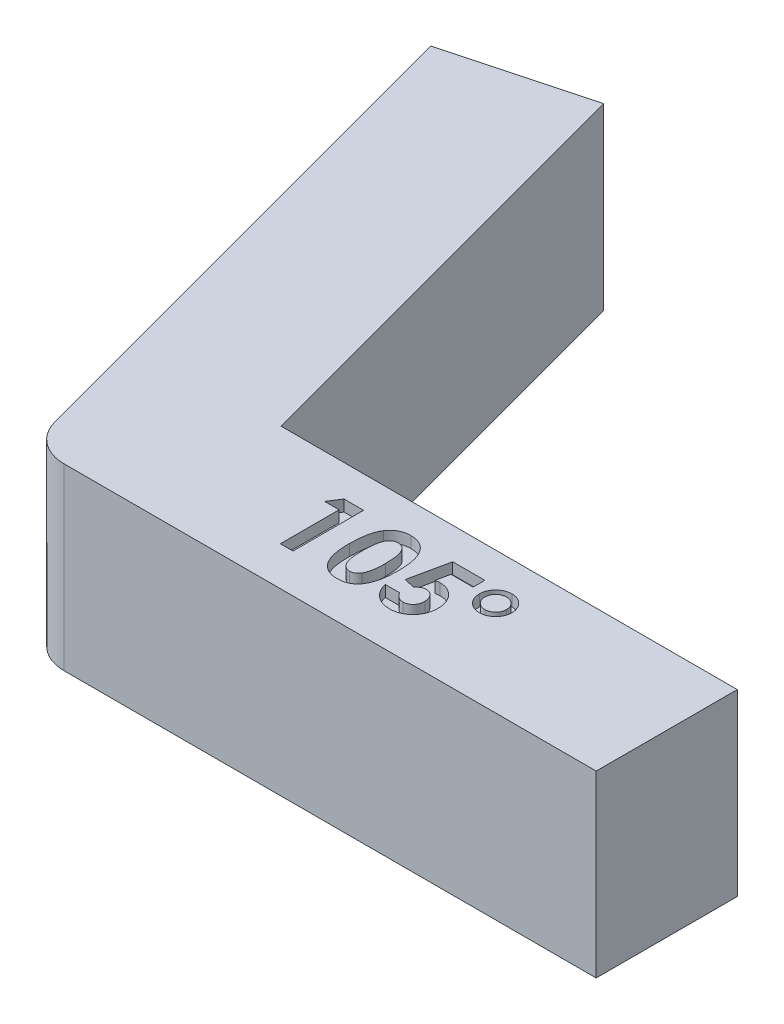
from build123d import *

# Parameters (mm, degrees)
BOSS_EXTRUDE1_DEPTH = 12.7
CUT_EXTRUDE1_DEPTH  = 0.8
FILLET1_R           = 3


with BuildPart() as part:
    # Sketch1 → Boss-Extrude1 (new body)
    with BuildSketch(Plane(origin=(0, 0, 0), x_dir=(1, 0, 0), z_dir=(0, 1, 0))):
        Polygon((0, 0), (-10.352761804, 38.637033052), (-0.693503541, 41.225223503), (7.67326988, 10), (40, 10), (40, 0), align=None)
    extrude(amount=BOSS_EXTRUDE1_DEPTH)

    # Sketch2 → Cut-Extrude1 (cut)
    # profile 1 of 4: a face of its own
    with BuildSketch(Plane(origin=(0, 12.7, 0), x_dir=(1, 0, 0), z_dir=(0, 1, 0))):
        Polygon((14.370390329, 7.760106671), (15.75760988, 7.760106671), (15.75760988, 2.760106671), (14.860173983, 2.760106671), (14.860173983, 6.926773337), (13.834532957, 6.926773337), align=None)
    # profile 2 of 4: a face of its own
    with BuildSketch(Plane(origin=(0, 12.7, 0), x_dir=(1, 0, 0), z_dir=(0, 1, 0))):
        with BuildLine():
            add(Edge.make_bspline(
                [(18.979765329, 7.888311799), (19.023204951, 7.887666925), (19.108618855, 7.886398932), (19.234417457, 7.87266553), (19.355596292, 7.851918189), (19.472629426, 7.822982884), (19.584674444, 7.784688038), (19.692546831, 7.738849764), (19.794962595, 7.68306375), (19.893227863, 7.620050582), (19.987304784, 7.548710743), (20.074932285, 7.467379643), (20.15771063, 7.377928714), (20.233847973, 7.279005618), (20.305030397, 7.171510166), (20.371024011, 7.055425313), (20.431323617, 6.930182901), (20.486605028, 6.795556919), (20.536037841, 6.649529384), (20.577675037, 6.490425295), (20.613385901, 6.318208318), (20.643528389, 6.132449779), (20.666311239, 5.932902762), (20.681667338, 5.719699834), (20.69220542, 5.49325202), (20.693065465, 5.33791068), (20.693507316, 5.258103466)],
                knots=[0, 0, 0, 0, 0.879237366, 1.728815576, 2.559023295, 3.367336655, 4.166867292, 4.954216142, 5.737608147, 6.525189134, 7.316157332, 8.124696809, 8.942788509, 9.781158001, 10.649253743, 11.551476218, 12.482711956, 13.461909668, 14.496590415, 15.601789533, 16.789733467, 18.056700938, 19.410929216, 20.8549011, 22.384193279, 24, 24, 24, 24], degree=3))
            add(Edge.make_bspline(
                [(20.693507316, 5.258103466), (20.693029794, 5.177297774), (20.692101978, 5.020293763), (20.682105409, 4.791774742), (20.664890846, 4.577023833), (20.642703474, 4.376063253), (20.612312843, 4.188999127), (20.57672119, 4.015347083), (20.534426763, 3.855170067), (20.483365649, 3.708828992), (20.428418857, 3.573966578), (20.367954307, 3.448968358), (20.303025886, 3.333495769), (20.235122857, 3.225806749), (20.160522527, 3.129075916), (20.082855903, 3.040013915), (19.998741242, 2.962013233), (19.911720097, 2.891054064), (19.81860453, 2.829731102), (19.72035482, 2.77609905), (19.615219342, 2.732597086), (19.505114539, 2.694761402), (19.388163653, 2.667599463), (19.266225015, 2.646047357), (19.137921964, 2.634136341), (19.05056808, 2.632658701), (19.005806996, 2.631901543)],
                knots=[0, 0, 0, 0, 1.643780988, 3.193836972, 4.651895693, 6.025988579, 7.305620092, 8.505800249, 9.631074763, 10.672816429, 11.65661981, 12.592235626, 13.49536222, 14.350718032, 15.179365177, 15.97804903, 16.751647189, 17.51006938, 18.259804725, 19.016521909, 19.783502495, 20.571750527, 21.382245291, 22.22305063, 23.089471752, 24, 24, 24, 24], degree=3))
            add(Edge.make_bspline(
                [(19.005806996, 2.631901543), (18.96104712, 2.632673306), (18.873363182, 2.634185181), (18.744713187, 2.645958793), (18.622128336, 2.667686771), (18.50425218, 2.694969931), (18.391905117, 2.732513371), (18.284548448, 2.777316883), (18.183007653, 2.830614297), (18.08700158, 2.892080136), (17.996858022, 2.962564534), (17.911176149, 3.041313582), (17.830145493, 3.128127672), (17.754998732, 3.223979192), (17.68450518, 3.327588726), (17.619399972, 3.440139443), (17.559722235, 3.561467473), (17.50360524, 3.691741934), (17.454846674, 3.833767485), (17.411453814, 3.988812398), (17.375907525, 4.158169099), (17.34731882, 4.341783181), (17.324493615, 4.539265649), (17.307514286, 4.750711822), (17.297462191, 4.976220188), (17.296544104, 5.13122332), (17.296071419, 5.211028145)],
                knots=[0, 0, 0, 0, 0.917216111, 1.796812873, 2.643793957, 3.46689424, 4.273913431, 5.068098542, 5.848489301, 6.620921603, 7.401012384, 8.190319798, 9.003608147, 9.831726257, 10.68377682, 11.569763213, 12.493818149, 13.453288342, 14.474581811, 15.568529029, 16.750744269, 18.018426408, 19.375425659, 20.823733699, 22.36466933, 24, 24, 24, 24], degree=3))
            add(Edge.make_bspline(
                [(17.296071419, 5.211028145), (17.296927644, 5.321910667), (17.298579742, 5.535859921), (17.319516343, 5.844954388), (17.350245962, 6.130658679), (17.395380494, 6.392494883), (17.451188718, 6.631432763), (17.522654055, 6.845898323), (17.604012143, 7.038859173), (17.673339685, 7.153170343), (17.70672847, 7.208223658)],
                knots=[0, 0, 0, 0, 1.288568992, 2.486310467, 3.599230591, 4.627010532, 5.572937695, 6.447898582, 7.252493626, 8, 8, 8, 8], degree=3))
            add(Edge.make_bspline(
                [(17.70672847, 7.208223658), (17.745551359, 7.262308017), (17.821457756, 7.368053597), (17.954182212, 7.506877776), (18.096777361, 7.625607013), (18.252172024, 7.721554357), (18.41790857, 7.79721844), (18.595409932, 7.85065913), (18.784020627, 7.881796166), (18.913542738, 7.886107488), (18.979765329, 7.888311799)],
                knots=[0, 0, 0, 0, 1.058512271, 2.069600068, 3.047294572, 4.004278952, 4.967380941, 5.939006123, 6.946246673, 8, 8, 8, 8], degree=3))
        make_face()
        with BuildLine():
            add(Edge.make_bspline(
                [(19.001800585, 6.990875901), (18.962530807, 6.989014592), (18.885541195, 6.985365438), (18.7738256, 6.954389264), (18.668484768, 6.906544894), (18.588354812, 6.848971674), (18.528378336, 6.79378084), (18.486472343, 6.743834929), (18.446060617, 6.688098892), (18.410366945, 6.624057649), (18.376662802, 6.554012276), (18.343723695, 6.47764481), (18.316722276, 6.393079501), (18.290194098, 6.301756507), (18.266952939, 6.201150989), (18.247481943, 6.090440608), (18.230086319, 5.968905405), (18.217952665, 5.836465774), (18.206640457, 5.693260279), (18.198531331, 5.538969914), (18.195141109, 5.373636304), (18.19406346, 5.259773501), (18.193507316, 5.201012119)],
                knots=[0, 0, 0, 0, 1.076674018, 2.110852608, 3.161083442, 4.239746716, 4.804137807, 5.395870207, 6.026861976, 6.692161227, 7.405688833, 8.16177676, 8.973626916, 9.841385931, 10.773283133, 11.807421078, 12.927755683, 14.143907515, 15.458935494, 16.872852025, 18.386167141, 20, 20, 20, 20], degree=3))
            add(Edge.make_bspline(
                [(18.193507316, 5.201012119), (18.194422662, 5.124883909), (18.196177905, 4.978902423), (18.205371046, 4.768975961), (18.223797936, 4.577925978), (18.246717266, 4.404457655), (18.278908401, 4.249695983), (18.315946385, 4.112176771), (18.361685003, 3.993653056), (18.414544788, 3.892410719), (18.473089383, 3.806284073), (18.536642115, 3.733076035), (18.603039243, 3.669681329), (18.674353236, 3.618186591), (18.750413962, 3.578723397), (18.830586452, 3.550338008), (18.914921655, 3.53296213), (18.972673533, 3.530552655), (19.001800585, 3.52933744)],
                knots=[0, 0, 0, 0, 1.771748488, 3.397459088, 4.888034009, 6.237357457, 7.467047327, 8.564189669, 9.548206622, 10.417051504, 11.216568818, 11.965764335, 12.669334354, 13.348544111, 14.005342236, 14.656555988, 15.322436492, 16, 16, 16, 16], degree=3))
            add(Edge.make_bspline(
                [(19.001800585, 3.52933744), (19.02992809, 3.53016898), (19.084998247, 3.531797032), (19.165302869, 3.548508769), (19.241244626, 3.575678423), (19.312594226, 3.614111807), (19.379606876, 3.662985734), (19.441955061, 3.722514978), (19.499168561, 3.793292907), (19.532501406, 3.845820599), (19.549677188, 3.872887119)],
                knots=[0, 0, 0, 0, 0.992283464, 1.942767638, 2.88273346, 3.832339453, 4.79467288, 5.803907806, 6.868395428, 8, 8, 8, 8], degree=3))
            add(Edge.make_bspline(
                [(19.549677188, 3.872887119), (19.569898778, 3.909872655), (19.612301813, 3.987428324), (19.661370678, 4.118300624), (19.702674113, 4.265902948), (19.738223377, 4.430694649), (19.762536904, 4.613325685), (19.783475684, 4.812637978), (19.793574978, 5.029635182), (19.795217683, 5.179971628), (19.796071419, 5.258103466)],
                knots=[0, 0, 0, 0, 0.710965849, 1.490837728, 2.352621235, 3.297892224, 4.334225155, 5.461620853, 6.680770821, 8, 8, 8, 8], degree=3))
            add(Edge.make_bspline(
                [(19.796071419, 5.258103466), (19.795741639, 5.336913525), (19.79510687, 5.488609436), (19.783460688, 5.70638676), (19.767242491, 5.905290203), (19.74351995, 6.084875694), (19.71299659, 6.245579187), (19.675376432, 6.387390177), (19.631025066, 6.510588146), (19.57842963, 6.615050249), (19.520176918, 6.703828707), (19.458339885, 6.779993738), (19.39265706, 6.845021519), (19.323238286, 6.899156763), (19.248476841, 6.940520149), (19.169800765, 6.969726122), (19.087048768, 6.987394755), (19.030600191, 6.989699857), (19.001800585, 6.990875901)],
                knots=[0, 0, 0, 0, 1.793836731, 3.452829483, 4.963243077, 6.335886805, 7.574563692, 8.684454726, 9.672768357, 10.54971625, 11.340229787, 12.085688095, 12.778991901, 13.440269426, 14.083255152, 14.715733572, 15.344777694, 16, 16, 16, 16], degree=3))
        make_face(mode=Mode.SUBTRACT)
    # profile 3 of 4: a face of its own
    with BuildSketch(Plane(origin=(0, 12.7, 0), x_dir=(1, 0, 0), z_dir=(0, 1, 0))):
        with BuildLine():
            Line((22.070710842, 7.760106671), (24.34735347, 7.760106671))
            Line((24.34735347, 7.760106671), (24.34735347, 6.926773337))
            Line((24.34735347, 6.926773337), (22.781848662, 6.926773337))
            Line((22.781848662, 6.926773337), (22.586536162, 5.981260517))
            add(Edge.make_bspline(
                [(22.586536162, 5.981260517), (22.613150286, 5.988672886), (22.665638807, 6.003291602), (22.744712828, 6.017952324), (22.821346575, 6.027454938), (22.871633172, 6.02872246), (22.896031355, 6.02933744)],
                knots=[0, 0, 0, 0, 1.05461699, 2.079921384, 3.068411212, 4, 4, 4, 4], degree=3))
            add(Edge.make_bspline(
                [(22.896031355, 6.02933744), (22.949197552, 6.028119167), (23.053999838, 6.025717684), (23.207312283, 6.002919771), (23.354118007, 5.967013749), (23.493967767, 5.915804353), (23.626724948, 5.849154002), (23.752550479, 5.76852576), (23.871598789, 5.673778016), (23.98175508, 5.564851449), (24.082971281, 5.445247612), (24.170972995, 5.315883407), (24.24613195, 5.178603442), (24.305910785, 5.032554387), (24.353093337, 4.878653528), (24.387188503, 4.716802242), (24.407350678, 4.546808709), (24.410069424, 4.430834276), (24.411456034, 4.371685196)],
                knots=[0, 0, 0, 0, 1.01440847, 1.999622559, 2.951875003, 3.895578053, 4.836219714, 5.782137149, 6.743708247, 7.735272588, 8.734977101, 9.730283169, 10.717124674, 11.717316708, 12.737475749, 13.78628267, 14.87096371, 16, 16, 16, 16], degree=3))
            add(Edge.make_bspline(
                [(24.411456034, 4.371685196), (24.409761575, 4.311864637), (24.40641791, 4.193821188), (24.384603565, 4.020255562), (24.346100853, 3.854018876), (24.293213527, 3.694666117), (24.223537859, 3.543368491), (24.139743333, 3.398558666), (24.040413209, 3.26131152), (23.926522255, 3.133034003), (23.802707849, 3.01578589), (23.670874734, 2.9126425), (23.531949077, 2.825848173), (23.385927527, 2.755703683), (23.233647854, 2.700206611), (23.075063842, 2.659807392), (22.909404791, 2.636640685), (22.79694382, 2.633498616), (22.739781355, 2.631901543)],
                knots=[0, 0, 0, 0, 1.06808661, 2.107647099, 3.116961351, 4.110378221, 5.100014249, 6.085620622, 7.093190682, 8.119403071, 9.144090782, 10.133780668, 11.103064255, 12.062861538, 13.020824475, 13.992378307, 14.979551724, 16, 16, 16, 16], degree=3))
            add(Edge.make_bspline(
                [(22.739781355, 2.631901543), (22.688662664, 2.633208048), (22.587845908, 2.63578475), (22.439347253, 2.651622518), (22.296178058, 2.679623839), (22.159098397, 2.720149003), (22.026665962, 2.770026227), (21.90041171, 2.832407122), (21.779641851, 2.906103871), (21.664699327, 2.989771507), (21.55745179, 3.084019854), (21.459567603, 3.187190909), (21.370454162, 3.29798425), (21.292018355, 3.41776673), (21.224506054, 3.546361378), (21.164634769, 3.682252677), (21.115629522, 3.826859765), (21.090760771, 3.927109432), (21.078122701, 3.978055389)],
                knots=[0, 0, 0, 0, 1.054957082, 2.080596141, 3.077793124, 4.061112343, 5.027190972, 5.994718051, 6.962465889, 7.943658696, 8.924948258, 9.904494768, 10.875059, 11.855380583, 12.854004648, 13.869083016, 14.917087635, 16, 16, 16, 16], degree=3))
            Line((21.078122701, 3.978055389), (22.103763727, 3.978055389))
            add(Edge.make_bspline(
                [(22.103763727, 3.978055389), (22.122512469, 3.942751915), (22.158948511, 3.874143644), (22.228257918, 3.783055854), (22.305845399, 3.7053801), (22.391011072, 3.640357474), (22.484306758, 3.591643628), (22.581930835, 3.554701302), (22.685109712, 3.533353699), (22.755379083, 3.530685037), (22.790863085, 3.52933744)],
                knots=[0, 0, 0, 0, 1.104910296, 2.147267069, 3.153527244, 4.136738762, 5.099945312, 6.05603338, 7.018353, 8, 8, 8, 8], degree=3))
            add(Edge.make_bspline(
                [(22.790863085, 3.52933744), (22.815594959, 3.530267968), (22.864255338, 3.532098796), (22.935948711, 3.54178434), (23.004383186, 3.56012854), (23.070067555, 3.585530993), (23.133178265, 3.617210721), (23.192810601, 3.657204313), (23.250002059, 3.703238421), (23.303881952, 3.756062715), (23.352681605, 3.814949516), (23.395473563, 3.878227398), (23.433735474, 3.944490313), (23.462076657, 4.016363101), (23.485285689, 4.091699615), (23.502377759, 4.171068142), (23.512592199, 4.254561377), (23.513537782, 4.311559868), (23.514020137, 4.340635517)],
                knots=[0, 0, 0, 0, 0.978869489, 1.925942215, 2.855067702, 3.774946051, 4.70828698, 5.642468714, 6.60995405, 7.609372294, 8.622401667, 9.629904756, 10.629323, 11.642352373, 12.678539694, 13.745912462, 14.850161547, 16, 16, 16, 16], degree=3))
            add(Edge.make_bspline(
                [(23.514020137, 4.340635517), (23.513460309, 4.369036254), (23.51237059, 4.424318977), (23.503356221, 4.505493818), (23.487229687, 4.58251405), (23.465257146, 4.655969593), (23.437129671, 4.725414388), (23.402756016, 4.791261805), (23.361989334, 4.853179007), (23.314610756, 4.909905423), (23.264086729, 4.961936505), (23.209807688, 5.007442475), (23.15226266, 5.04520927), (23.093239786, 5.078180782), (23.030383084, 5.102176729), (22.965105949, 5.118701852), (22.897477029, 5.130827323), (22.851348811, 5.131539739), (22.82792238, 5.131901543)],
                knots=[0, 0, 0, 0, 1.166249705, 2.270133367, 3.348514167, 4.393962215, 5.415026464, 6.420877785, 7.440098956, 8.453121383, 9.451844239, 10.415694839, 11.355045125, 12.27538808, 13.187007209, 14.108269027, 15.039275622, 16, 16, 16, 16], degree=3))
            add(Edge.make_bspline(
                [(22.82792238, 5.131901543), (22.802475832, 5.130935987), (22.751475491, 5.129000808), (22.675701748, 5.113254768), (22.600841626, 5.087771769), (22.526478825, 5.052613933), (22.453351525, 5.006603419), (22.379529861, 4.952638362), (22.307484802, 4.886797687), (22.26167655, 4.837759403), (22.23797847, 4.812390325)],
                knots=[0, 0, 0, 0, 0.88288272, 1.769486374, 2.674910571, 3.623812639, 4.617874466, 5.670434592, 6.794841017, 8, 8, 8, 8], degree=3))
            Line((22.23797847, 4.812390325), (21.482770137, 4.985667568))
            Line((21.482770137, 4.985667568), (22.070710842, 7.760106671))
        make_face()
    # profile 4 of 4: a face of its own
    with BuildSketch(Plane(origin=(0, 12.7, 0), x_dir=(1, 0, 0), z_dir=(0, 1, 0))):
        with BuildLine():
            add(Edge.make_bspline(
                [(27.296071419, 6.734465645), (27.295210797, 6.694683251), (27.293518368, 6.616450387), (27.277087975, 6.50128345), (27.249561652, 6.391274768), (27.214269295, 6.284825401), (27.165231892, 6.184679956), (27.107181894, 6.088615756), (27.037104988, 5.998421816), (26.958975387, 5.913026829), (26.873148359, 5.835232039), (26.781982443, 5.766489246), (26.685196648, 5.709560842), (26.584861561, 5.661891149), (26.47961524, 5.625725336), (26.370235833, 5.599965119), (26.256263549, 5.583073458), (26.178677903, 5.58144677), (26.139220457, 5.580619491)],
                knots=[0, 0, 0, 0, 1.048753193, 2.062393874, 3.059725798, 4.03711221, 5.013824111, 5.993903926, 6.992478922, 8.020738441, 9.043061753, 10.043343452, 11.026424807, 11.999358773, 12.968420071, 13.955122655, 14.960044262, 16, 16, 16, 16], degree=3))
            add(Edge.make_bspline(
                [(26.139220457, 5.580619491), (26.099760091, 5.5814386), (26.022168702, 5.583049225), (25.908238128, 5.600057554), (25.798597159, 5.62541284), (25.693815195, 5.663210264), (25.593398125, 5.710219597), (25.497466965, 5.767571006), (25.406871412, 5.836512178), (25.321860697, 5.914782175), (25.243868822, 6.000460866), (25.175561304, 6.092071742), (25.116564132, 6.188098064), (25.071065989, 6.290645258), (25.033098113, 6.396842324), (25.007837008, 6.508517909), (24.990757849, 6.624762868), (24.989183078, 6.704019037), (24.988379111, 6.744481671)],
                knots=[0, 0, 0, 0, 1.037227242, 2.039512271, 3.023626077, 3.993053151, 4.963434463, 5.936395473, 6.927031705, 7.952593414, 8.972234493, 9.969891786, 10.954906455, 11.929570282, 12.915563215, 13.916770353, 14.936449251, 16, 16, 16, 16], degree=3))
            add(Edge.make_bspline(
                [(24.988379111, 6.744481671), (24.989217147, 6.783270661), (24.990864634, 6.859525533), (25.007654613, 6.97193011), (25.034301677, 7.080127039), (25.072675764, 7.183761604), (25.121628491, 7.282677252), (25.179187724, 7.378632208), (25.250436107, 7.468490955), (25.329840343, 7.554241702), (25.416922569, 7.632488777), (25.509357418, 7.701138254), (25.606208378, 7.758490543), (25.706818767, 7.805765091), (25.811331933, 7.843330457), (25.920556095, 7.869017257), (26.03353198, 7.885758756), (26.11044776, 7.887455918), (26.149236483, 7.888311799)],
                knots=[0, 0, 0, 0, 1.027628768, 2.020204677, 3.0054932, 3.977172113, 4.942988595, 5.928118098, 6.937247537, 7.976812879, 9.023474825, 10.036014018, 11.024160528, 12.002107364, 12.979092523, 13.962271943, 14.972371232, 16, 16, 16, 16], degree=3))
            add(Edge.make_bspline(
                [(26.149236483, 7.888311799), (26.18802861, 7.887478405), (26.264620366, 7.885832941), (26.377223927, 7.868876485), (26.48586431, 7.843507228), (26.589669465, 7.805747425), (26.689258619, 7.758450335), (26.784981114, 7.701377508), (26.87562597, 7.632460187), (26.960543425, 7.553806871), (27.039649068, 7.468836574), (27.107616925, 7.376998815), (27.166708135, 7.281642465), (27.213400434, 7.180820555), (27.251290465, 7.076103392), (27.276740728, 6.966128397), (27.293576038, 6.851841306), (27.295232549, 6.773923681), (27.296071419, 6.734465645)],
                knots=[0, 0, 0, 0, 1.02774298, 2.029191086, 3.012479778, 3.981238486, 4.951290381, 5.931946007, 6.930416638, 7.964088953, 8.997761269, 10.003308488, 10.98854748, 11.966603007, 12.943696749, 13.935593372, 14.954569896, 16, 16, 16, 16], degree=3))
        make_face()
        with BuildLine():
            add(Edge.make_bspline(
                [(26.911456034, 6.729457632), (26.911087036, 6.756215104), (26.910359524, 6.808969839), (26.89835619, 6.886271889), (26.881808652, 6.960863079), (26.857718745, 7.032074138), (26.826634873, 7.099663536), (26.787695178, 7.163342648), (26.743005785, 7.224492225), (26.690947652, 7.281223144), (26.634089974, 7.332459249), (26.575253233, 7.379665821), (26.511574006, 7.41759967), (26.445194878, 7.448284854), (26.376630601, 7.474566798), (26.304335391, 7.490356591), (26.229450228, 7.502703519), (26.178339201, 7.503360799), (26.152241291, 7.503696414)],
                knots=[0, 0, 0, 0, 1.061377507, 2.092600128, 3.099240629, 4.0928758, 5.071628549, 6.047053269, 7.052033583, 8.074955974, 9.097878365, 10.089742981, 11.0651677, 12.031904106, 12.992438743, 13.973254576, 14.965119192, 16, 16, 16, 16], degree=3))
            add(Edge.make_bspline(
                [(26.152241291, 7.503696414), (26.125816129, 7.503316781), (26.073392045, 7.502563637), (25.996780453, 7.490597271), (25.922566214, 7.474419296), (25.852394467, 7.448171319), (25.783684806, 7.418226502), (25.719751033, 7.377678788), (25.656781194, 7.333449507), (25.600007766, 7.280017719), (25.546409451, 7.223615872), (25.500780787, 7.162353306), (25.461124847, 7.098910176), (25.428652039, 7.032174219), (25.404018965, 6.962185285), (25.385395241, 6.889538518), (25.375772573, 6.813848191), (25.373930261, 6.762533252), (25.372994496, 6.73646885)],
                knots=[0, 0, 0, 0, 1.04110597, 2.065418807, 3.052483904, 4.031345003, 5.015506832, 6.002484077, 7.011358201, 8.046031082, 9.071020927, 10.07714091, 11.052896618, 12.018827533, 12.997688631, 13.975042629, 14.971463175, 16, 16, 16, 16], degree=3))
            add(Edge.make_bspline(
                [(25.372994496, 6.73646885), (25.373927865, 6.710736959), (25.375765173, 6.660084544), (25.385419178, 6.585402877), (25.403934647, 6.513699999), (25.429195183, 6.444347919), (25.460639302, 6.376905325), (25.501945009, 6.313876202), (25.547945133, 6.25188387), (25.601615774, 6.193846864), (25.659693892, 6.140272244), (25.721891557, 6.09352728), (25.786365255, 6.053457224), (25.854059833, 6.021364165), (25.923764702, 5.996021093), (25.996183287, 5.977679403), (26.071852835, 5.968001504), (26.12317063, 5.966166785), (26.149236483, 5.965234876)],
                knots=[0, 0, 0, 0, 1.017878107, 2.003660885, 2.970612419, 3.939454555, 4.919652619, 5.904816436, 6.913406512, 7.969270601, 9.02513469, 10.033724766, 11.041277553, 12.021475617, 12.990317753, 13.970071221, 14.968938047, 16, 16, 16, 16], degree=3))
            add(Edge.make_bspline(
                [(26.149236483, 5.965234876), (26.174965602, 5.966174933), (26.22561256, 5.968025404), (26.300333913, 5.977583671), (26.371476339, 5.99634506), (26.440702666, 6.019996511), (26.50629654, 6.052640561), (26.570370363, 6.090477265), (26.630066609, 6.13710064), (26.686860468, 6.189096981), (26.740108975, 6.24504147), (26.78458223, 6.306894073), (26.824317045, 6.370003877), (26.856842585, 6.436299456), (26.880159897, 6.505937763), (26.899251836, 6.577668038), (26.908590361, 6.652759823), (26.910494826, 6.703731531), (26.911456034, 6.729457632)],
                knots=[0, 0, 0, 0, 1.030660162, 2.028821957, 3.007916034, 3.971836568, 4.952298414, 5.935762656, 6.946377494, 7.977730887, 9.018140113, 10.031403548, 11.021837986, 12.002299832, 12.978835615, 13.957929692, 14.969339838, 16, 16, 16, 16], degree=3))
        make_face(mode=Mode.SUBTRACT)
    extrude(amount=-CUT_EXTRUDE1_DEPTH, mode=Mode.SUBTRACT)

    # Fillet1
    fillet1_edges = [part.edges().sort_by_distance(p)[0] for p in [
        (0, 6.35, 0),
    ]]
    fillet(fillet1_edges, radius=FILLET1_R)


solid = part.part
